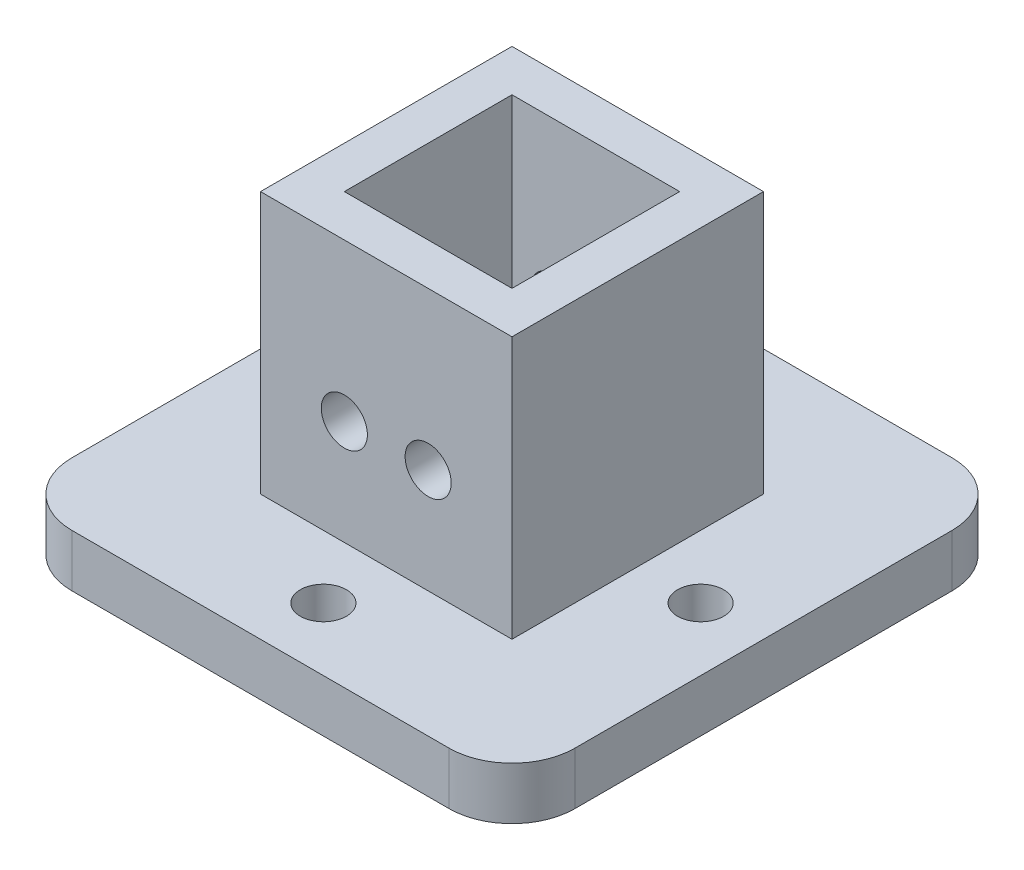
from build123d import *

# Parameters (mm, degrees)
SKETCH_1_W          = 24
SKETCH_1_H          = 24
SKETCH_1_W_2        = 16
SKETCH_1_H_2        = 16
EXTRUDE_1_DEPTH     = 30
SKETCH_2_R          = 2.2
CUT_EXTRUDE_1_DEPTH = 31
SKETCH_3_W          = 6
SKETCH_3_H          = 6
SKETCH_3_W_2        = 24
SKETCH_3_H_2        = 24
EXTRUDE_3_DEPTH     = 5
FILLET_1_R          = 6
SKETCH_4_R          = 2.2
CUT_EXTRUDE_2_DEPTH = 5


with BuildPart() as part:
    # 草图1 → 凸台-拉伸1 (new body)
    with BuildSketch(Plane(origin=(0, 0, 0), x_dir=(1, 0, 0), z_dir=(0, 1, 0))):
        with Locations((12, 12)):
            Rectangle(SKETCH_1_W, SKETCH_1_H)
        with Locations((12, 12)):
            Rectangle(SKETCH_1_W_2, SKETCH_1_H_2, mode=Mode.SUBTRACT)
    extrude(amount=EXTRUDE_1_DEPTH)

    # 草图2 → 切除-拉伸1 (cut)
    with BuildSketch(Plane.XY):
        with Locations(Location((8, 15, 0), (0, 0, 180))):
            Circle(SKETCH_2_R)
        with Locations(Location((16, 15, 0), (0, 0, 180))):
            Circle(SKETCH_2_R)
    extrude(amount=-CUT_EXTRUDE_1_DEPTH, mode=Mode.SUBTRACT)

    # 草图3 → 凸台-拉伸3 (add)
    # profile 1 of 5: a face of its own
    with BuildSketch(Plane.XZ):
        with Locations((-9, -33)):
            Rectangle(SKETCH_3_W, SKETCH_3_H)
    # profile 2 of 5: a face of its own
    with BuildSketch(Plane.XZ):
        Polygon((-12, -30), (-6, -30), (-6, 6), (0, 6), (30, 6), (30, 12), (-12, 12), align=None)
    # profile 3 of 5: a face of its own
    with BuildSketch(Plane.XZ):
        Polygon((30, -30), (30, 6), (0, 6), (-6, 6), (-6, -30), align=None)
        with Locations((12, -12)):
            Rectangle(SKETCH_3_W_2, SKETCH_3_H_2, mode=Mode.SUBTRACT)
    # profile 4 of 5: a face of its own
    with BuildSketch(Plane.XZ):
        Polygon((30, -30), (-6, -30), (-6, -36), (36, -36), (36, 6), (30, 6), align=None)
    # profile 5 of 5: a face of its own
    with BuildSketch(Plane.XZ):
        with Locations((33, 9)):
            Rectangle(SKETCH_3_W, SKETCH_3_H)
    extrude(amount=-EXTRUDE_3_DEPTH)

    # 圆角1
    fillet_1_edges = [part.edges().sort_by_distance(p)[0] for p in [
        (36, 2.5, 12),
        (36, 2.5, -36),
        (-12, 2.5, -36),
        (-12, 2.5, 12),
    ]]
    fillet(fillet_1_edges, radius=FILLET_1_R)

    # 草图4 → 切除-拉伸2 (cut)
    with BuildSketch(Plane(origin=(0, 5, 0), x_dir=(1, 0, 0), z_dir=(0, 1, 0))):
        with Locations(Location((12, -6, 0), (0, 0, 270))):
            Circle(SKETCH_4_R)
        with Locations(Location((-6, 12, 0), (0, 0, 270))):
            Circle(SKETCH_4_R)
        with Locations(Location((12, 30, 0), (0, 0, 270))):
            Circle(SKETCH_4_R)
        with Locations(Location((30, 12, 0), (0, 0, 270))):
            Circle(SKETCH_4_R)
    extrude(amount=-CUT_EXTRUDE_2_DEPTH, mode=Mode.SUBTRACT)


solid = part.part
